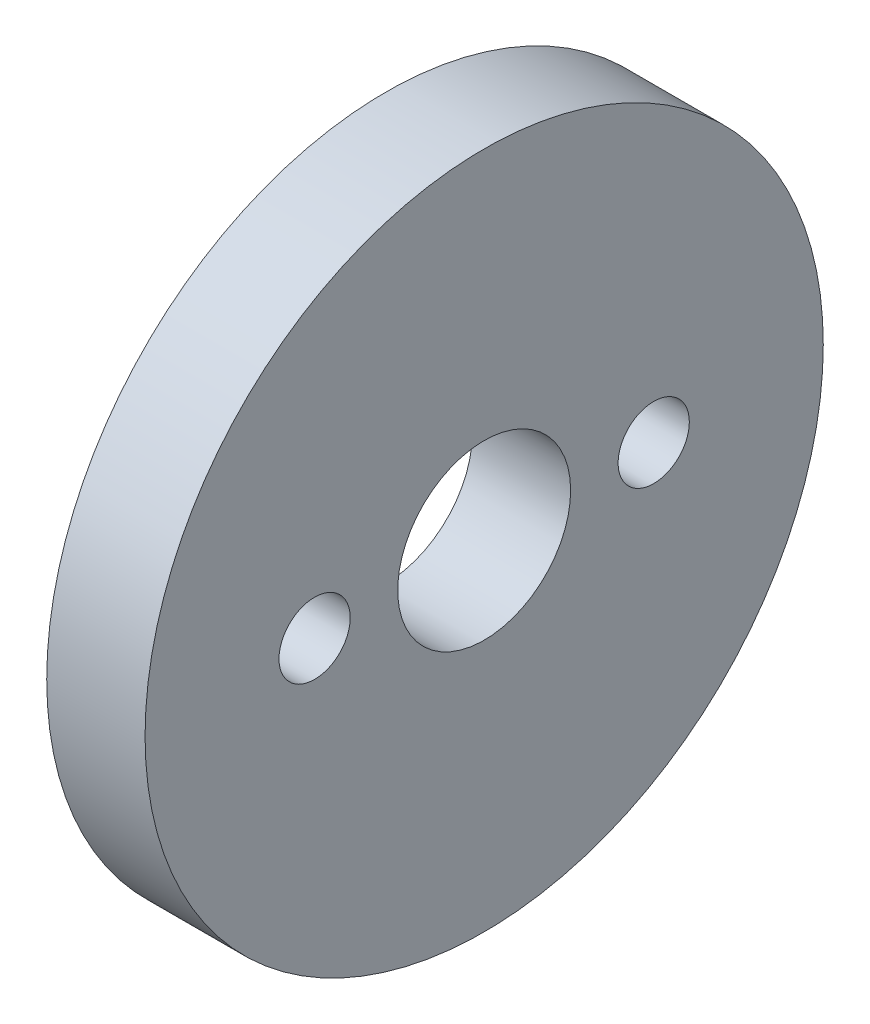
from build123d import *

# Parameters (mm, degrees)
SKETCH_1_R          = 20
EXTRUDE_1_DEPTH     = 5.8
SKETCH_2_R          = 2.1
SKETCH_2_R_2        = 5.1
CUT_EXTRUDE_1_DEPTH = 29.872824593


with BuildPart() as part:
    # ｽｹｯﾁ1 → ﾎﾞｽ - 押し出し1 (new body)
    with BuildSketch(Plane(origin=(0, 0, 0), x_dir=(0, 0, -1), z_dir=(1, 0, 0))):
        Circle(SKETCH_1_R)
    extrude(amount=EXTRUDE_1_DEPTH)

    # ｽｹｯﾁ2 → ｶｯﾄ - 押し出し1 (cut, through all)
    with BuildSketch(Plane(origin=(5.8, 0, 0), x_dir=(0, 0, -1), z_dir=(1, 0, 0))):
        with Locations((10, 0)):
            Circle(SKETCH_2_R)
        with Locations(Location((-10, 0, 0), (0, 0, 180))):
            Circle(SKETCH_2_R)
        Circle(SKETCH_2_R_2)
    extrude(amount=-CUT_EXTRUDE_1_DEPTH, mode=Mode.SUBTRACT)


solid = part.part
